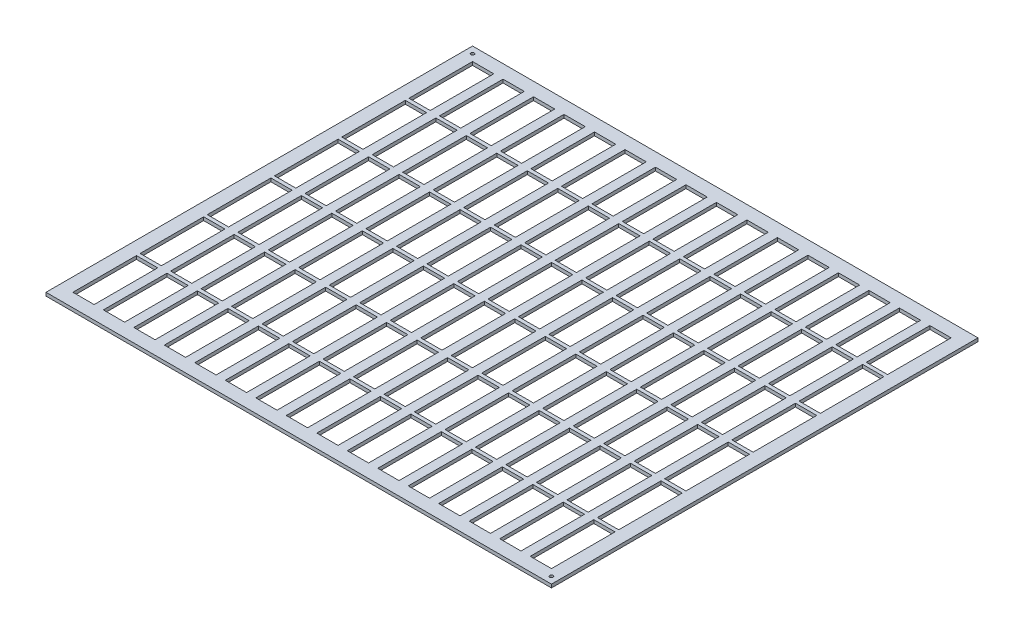
from build123d import *

# Parameters (mm, degrees)
SKETCH1_W            = 477.8375
SKETCH1_H            = 403.225
BOSS_EXTRUDE1_DEPTH  = 3.175
SKETCH2_W            = 20.1
SKETCH2_H            = 60.1
CUT_EXTRUDE1_DEPTH   = 313.633731198
LPATTERN2_COUNT      = 16
LPATTERN2_PITCH      = 28.8225
LPATTERN2_COUNT_DIR2 = 6
LPATTERN2_PITCH_DIR2 = 63.545
SKETCH4_R            = 1.5875
CUT_EXTRUDE2_DEPTH   = 313.633731198


with BuildPart() as part:
    # Sketch1 → Boss-Extrude1 (new body)
    with BuildSketch(Plane(origin=(0, 0, 0), x_dir=(1, 0, 0), z_dir=(0, 1, 0))):
        Rectangle(SKETCH1_W, SKETCH1_H)
    extrude(amount=BOSS_EXTRUDE1_DEPTH)

    # Sketch2 → Cut-Extrude1 (cut, through all)
    with BuildSketch(Plane(origin=(0, 0, 0), x_dir=(1, 0, 0), z_dir=(0, 1, 0))):
        with Locations((-216.16875, 158.8625)):
            Rectangle(SKETCH2_W, SKETCH2_H)
    cut_extrude1 = extrude(amount=CUT_EXTRUDE1_DEPTH, mode=Mode.SUBTRACT)

    # LPattern2: Cut-Extrude1 16 × 6
    with Locations(*[(i * LPATTERN2_PITCH, 0, j * LPATTERN2_PITCH_DIR2) for i in range(LPATTERN2_COUNT) for j in range(LPATTERN2_COUNT_DIR2) if (i, j) != (0, 0)]):
        add(cut_extrude1, mode=Mode.SUBTRACT)

    # Sketch4 → Cut-Extrude2 (cut, through all)
    with BuildSketch(Plane(origin=(0, 0, 0), x_dir=(1, 0, 0), z_dir=(0, 1, 0))):
        with Locations(Location((-232.56875, 195.2625, 0), (0, 0, 270))):
            Circle(SKETCH4_R)
        with Locations(Location((232.56875, -195.2625, 0), (0, 0, 270))):
            Circle(SKETCH4_R)
    extrude(amount=CUT_EXTRUDE2_DEPTH, mode=Mode.SUBTRACT)


solid = part.part
